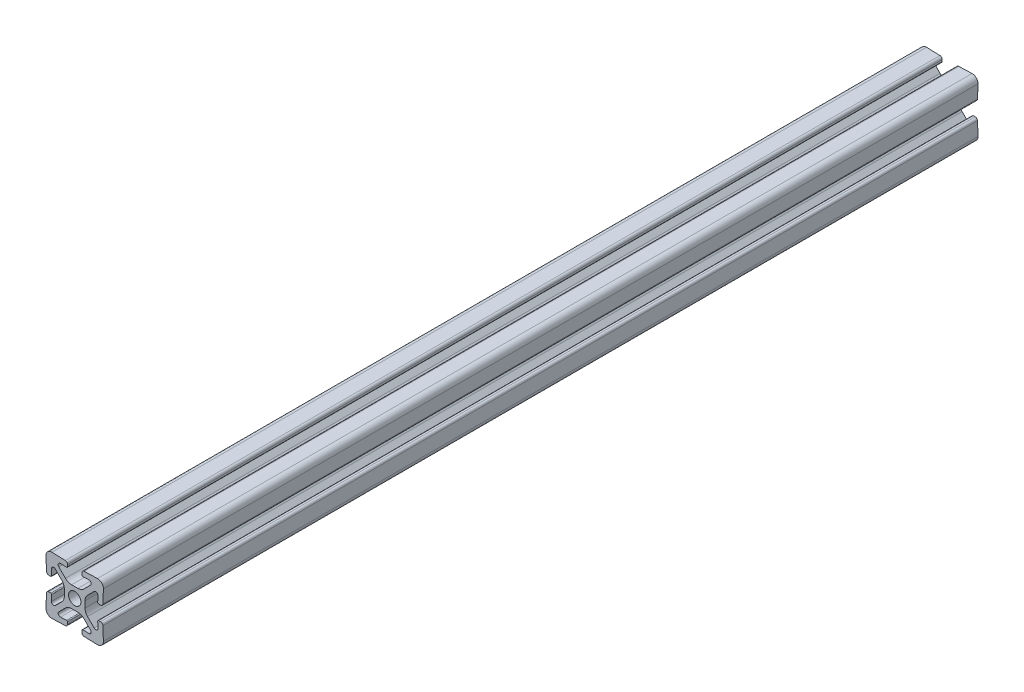
from build123d import *

# Parameters (mm, degrees)
BOSS_EXTRUDE1_DEPTH = 152.4
CIRPATTERN1_COUNT   = 4


with BuildPart() as part:
    # Sketch3 → Boss-Extrude1 (new, symmetric)
    with BuildSketch(Plane.XY):
        with BuildLine():
            Line((-2.524916986, 8.30911066), (-2.500487338, 9.008684239))
            ThreePointArc((-2.500487338, 9.008684239), (-2.714917039, 9.582202525), (-3.272080403, 9.836116498))
            Line((-3.272080403, 9.836116498), (-7.930201007, 9.998781654))
            ThreePointArc((-7.930201007, 9.998781654), (-9.414213562, 9.414213562), (-9.998781654, 7.930201007))
            Line((-9.998781654, 7.930201007), (-9.836116498, 3.272080403))
            ThreePointArc((-9.836116498, 3.272080403), (-9.582202525, 2.714917039), (-9.008684239, 2.500487338))
            Line((-9.008684239, 2.500487338), (-8.30911066, 2.524916986))
            ThreePointArc((-8.30911066, 2.524916986), (-8.100174399, 2.620134726), (-8.019763261, 2.835204083))
            Line((-8.019763261, 2.835204083), (-8.093719461, 4.953032548))
            ThreePointArc((-8.093719461, 4.953032548), (-7.631170264, 5.686128657), (-6.779559917, 5.52444538))
            Line((-6.779559917, 5.52444538), (-4.478679656, 3.22356512))
            ThreePointArc((-4.478679656, 3.22356512), (-3.828361402, 2.250295073), (-3.6, 1.102244776))
            Line((-3.6, 1.102244776), (-3.6, 0))
            Line((-3.6, 0), (-2.15, 0))
            ThreePointArc((-2.15, 0), (-1.52027958, 1.52027958), (0, 2.15))
            Line((0, 2.15), (0, 3.6))
            Line((0, 3.6), (-1.102244776, 3.6))
            ThreePointArc((-1.102244776, 3.6), (-2.250295073, 3.828361402), (-3.22356512, 4.478679656))
            Line((-3.22356512, 4.478679656), (-5.52444538, 6.779559917))
            ThreePointArc((-5.52444538, 6.779559917), (-5.686128657, 7.631170264), (-4.953032548, 8.093719461))
            Line((-4.953032548, 8.093719461), (-2.835204083, 8.019763261))
            ThreePointArc((-2.835204083, 8.019763261), (-2.620134726, 8.100174399), (-2.524916986, 8.30911066))
        make_face()
    boss_extrude1 = extrude(amount=BOSS_EXTRUDE1_DEPTH, both=True)

    # CirPattern1: Boss-Extrude1 ×4 about axis
    cirpattern1_axis = Axis((0, 0, 0), (0, 0, 1))
    for i in range(1, CIRPATTERN1_COUNT):
        add(boss_extrude1.rotate(cirpattern1_axis, i * 360 / CIRPATTERN1_COUNT))


solid = part.part
